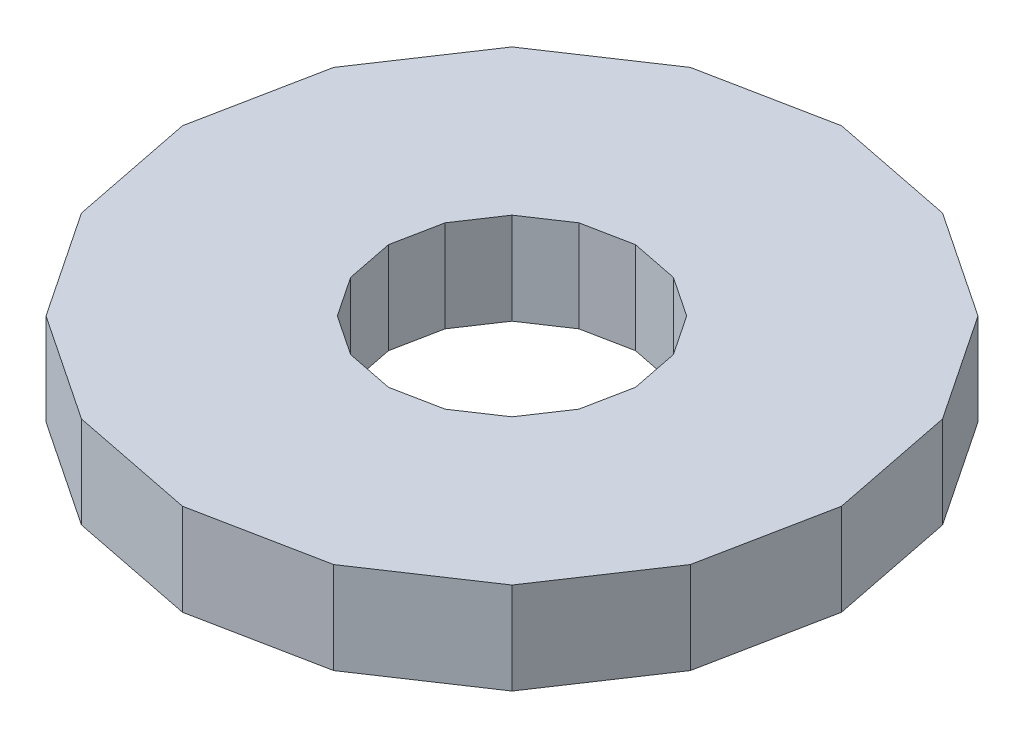
from build123d import *

# Parameters (mm, degrees)
BOSS_EXTRUDE2_DEPTH = 19.05


with BuildPart() as part:
    # Sketch2 → Boss-Extrude2 (new body)
    with BuildSketch(Plane(origin=(0, 0, 0), x_dir=(1, 0, 0), z_dir=(0, 1, 0))):
        Polygon((-68.352954991, 0), (-63.149896103, -26.157543428), (-48.332837988, -48.332837988), (-26.157543428, -63.149896103), (0, -68.352954991), (26.157543428, -63.149896103), (48.332837988, -48.332837988), (63.149896103, -26.157543428), (68.352954991, 0), (63.149896103, 26.157543428), (48.332837988, 48.332837988), (26.157543428, 63.149896103), (0, 68.352954991), (-26.157543428, 63.149896103), (-48.332837988, 48.332837988), (-63.149896103, 26.157543428), align=None)
        Polygon((-25.621889551, 0), (-23.67153934, -9.805072637), (-18.117411848, -18.117411848), (-9.805072637, -23.67153934), (0, -25.621889551), (9.805072637, -23.67153934), (18.117411848, -18.117411848), (23.67153934, -9.805072637), (25.621889551, 0), (23.67153934, 9.805072637), (18.117411848, 18.117411848), (9.805072637, 23.67153934), (0, 25.621889551), (-9.805072637, 23.67153934), (-18.117411848, 18.117411848), (-23.67153934, 9.805072637), align=None, mode=Mode.SUBTRACT)
    extrude(amount=BOSS_EXTRUDE2_DEPTH)


solid = part.part
